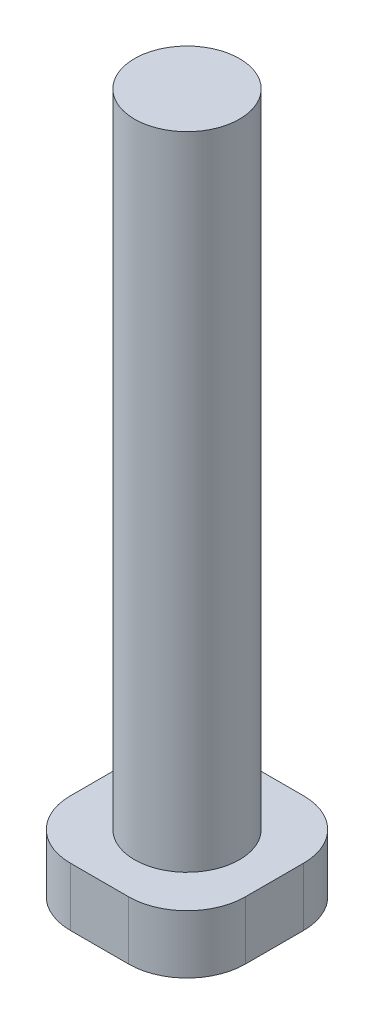
from build123d import *

# Parameters (mm, degrees)
SKETCH1_W           = 7.62
SKETCH1_H           = 7.62
BOSS_EXTRUDE1_DEPTH = 30.48
SKETCH2_W           = 7.62
SKETCH2_H           = 7.62
SKETCH2_R           = 2.286
CUT_EXTRUDE1_DEPTH  = 27.94
FILLET1_R           = 2.54
FILLET2_R           = 2.54
FILLET3_R           = 2.54
FILLET4_R           = 2.54


with BuildPart() as part:
    # Sketch1 → Boss-Extrude1 (new body)
    with BuildSketch(Plane(origin=(0, 0, 0), x_dir=(1, 0, 0), z_dir=(0, 1, 0))):
        with Locations((3.81, 3.81)):
            Rectangle(SKETCH1_W, SKETCH1_H)
    extrude(amount=BOSS_EXTRUDE1_DEPTH)

    # Sketch2 → Cut-Extrude1 (cut)
    with BuildSketch(Plane(origin=(0, 30.48, 0), x_dir=(1, 0, 0), z_dir=(0, 1, 0))):
        with Locations((3.81, 3.81)):
            Rectangle(SKETCH2_W, SKETCH2_H)
        with Locations(Location((3.81, 3.81, 0), (0, 0, 270))):
            Circle(SKETCH2_R, mode=Mode.SUBTRACT)
    extrude(amount=-CUT_EXTRUDE1_DEPTH, mode=Mode.SUBTRACT)

    # Fillet1
    fillet1_edges = [part.edges().sort_by_distance(p)[0] for p in [
        (7.62, 1.27, 0),
    ]]
    fillet(fillet1_edges, radius=FILLET1_R)

    # Fillet2
    fillet2_edges = [part.edges().sort_by_distance(p)[0] for p in [
        (7.62, 1.27, -7.62),
    ]]
    fillet(fillet2_edges, radius=FILLET2_R)

    # Fillet3
    fillet3_edges = [part.edges().sort_by_distance(p)[0] for p in [
        (0, 1.27, 0),
    ]]
    fillet(fillet3_edges, radius=FILLET3_R)

    # Fillet4
    fillet4_edges = [part.edges().sort_by_distance(p)[0] for p in [
        (0, 1.27, -7.62),
    ]]
    fillet(fillet4_edges, radius=FILLET4_R)


solid = part.part
